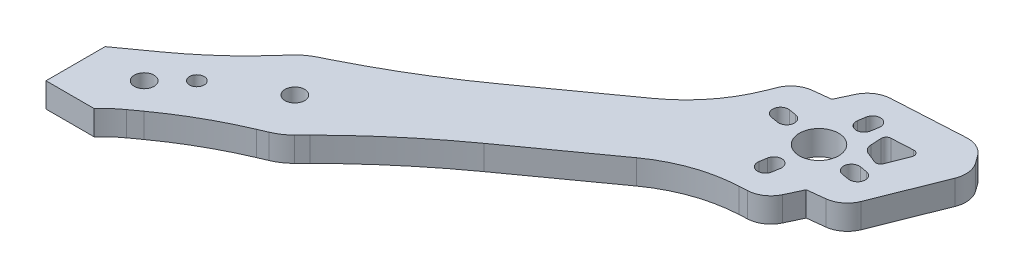
from build123d import *

# Parameters (mm, degrees)
SKETCH2_R           = 2
SKETCH2_R_2         = 1.5
SKETCH2_R_3         = 4
BOSS_EXTRUDE1_DEPTH = 5


with BuildPart() as part:
    # Sketch2 → Boss-Extrude1 (new body)
    with BuildSketch(Plane(origin=(0, 0, 0), x_dir=(1, 0, 0), z_dir=(0, 1, 0))):
        with BuildLine():
            Line((96.674187099, 58.214174471), (100.259554689, 58.62537792))
            ThreePointArc((100.259554689, 58.62537792), (102.726861183, 59.620848143), (104.334258678, 61.740950876))
            Line((104.334258678, 61.740950876), (109.788302134, 75.41951978))
            ThreePointArc((109.788302134, 75.41951978), (110.106786378, 77.879348033), (109.203962948, 80.189563845))
            Line((109.203962948, 80.189563845), (108.148744134, 81.65769437))
            ThreePointArc((108.148744134, 81.65769437), (106.246786582, 83.249782532), (103.813742867, 83.731950064))
            Line((103.813742867, 83.731950064), (89.110198155, 82.922252473))
            ThreePointArc((89.110198155, 82.922252473), (86.58833532, 82.074449344), (84.858361795, 80.053124553))
            Line((84.858361795, 80.053124553), (83.325812901, 76.785825529))
            Line((83.325812901, 76.785825529), (79.745407576, 76.375191199))
            ThreePointArc((79.745407576, 76.375191199), (77.270804519, 75.374131292), (75.6639264, 73.24253003))
            Line((75.6639264, 73.24253003), (75.042843012, 71.6680711))
            ThreePointArc((75.042843012, 71.6680711), (70.946054903, 64.491253119), (64.991367673, 58.761323876))
            Line((64.991367673, 58.761323876), (46.931722679, 45.780954047))
            ThreePointArc((46.931722679, 45.780954047), (36.413241445, 38.843477801), (25.372306119, 32.77184118))
            Line((25.372306119, 32.77184118), (23.401205332, 31.788764494))
            ThreePointArc((23.401205332, 31.788764494), (21.793071121, 30.786042702), (20.402989885, 29.497935256))
            Line((20.402989885, 29.497935256), (19.112268572, 28.051458372))
            ThreePointArc((19.112268572, 28.051458372), (13.16458677, 22.078961314), (6.599736248, 16.792338805))
            Line((6.599736248, 16.792338805), (0, 12.048778377))
            Line((0, 12.048778377), (0, 0))
            Line((0, 0), (9.827416163, 0))
            ThreePointArc((9.827416163, 0), (11.473121255, 1.662110783), (13.293458997, 3.130895317))
            Line((13.293458997, 3.130895317), (15.354276971, 4.612108235))
            ThreePointArc((15.354276971, 4.612108235), (22.457631343, 9.149507995), (30.014371949, 12.883314543))
            Line((30.014371949, 12.883314543), (31.796806607, 13.645668513))
            ThreePointArc((31.796806607, 13.645668513), (33.460801696, 14.552678424), (34.923797775, 15.757331529))
            Line((34.923797775, 15.757331529), (36.483864554, 17.312281519))
            ThreePointArc((36.483864554, 17.312281519), (45.757987001, 25.842092678), (55.686263447, 33.60072351))
            Line((55.686263447, 33.60072351), (73.745908403, 46.581093312))
            ThreePointArc((73.745908403, 46.581093312), (81.074965721, 50.398855458), (89.183263316, 51.994442832))
            Line((89.183263316, 51.994442832), (90.873565855, 52.081292528))
            ThreePointArc((90.873565855, 52.081292528), (93.406161944, 52.924938353), (95.143759302, 54.951397494))
            Line((95.143759302, 54.951397494), (96.674187099, 58.214174471))
        make_face()
        with Locations(Location((10.000016395, 10.000011804, 0), (0, 0, 270))):
            Circle(SKETCH2_R, mode=Mode.SUBTRACT)
        with Locations(Location((27.864354565, 22.840004863, 0), (0, 0, 270))):
            Circle(SKETCH2_R, mode=Mode.SUBTRACT)
        with Locations(Location((15.365, 15.365, 0), (0, 0, 270))):
            Circle(SKETCH2_R_2, mode=Mode.SUBTRACT)
        with Locations(Location((90, 67.5, 0), (0, 0, 270))):
            Circle(SKETCH2_R_3, mode=Mode.SUBTRACT)
        with BuildLine():
            Line((100.618872181, 76.169797692), (96.189048483, 75.92936815))
            ThreePointArc((96.189048483, 75.92936815), (95.498854377, 75.598583427), (95.244713564, 74.876642374))
            Line((95.244713564, 74.876642374), (95.363815249, 72.682238728))
            ThreePointArc((95.363815249, 72.682238728), (95.736845201, 71.623357489), (96.621599456, 70.932278091))
            Line((96.621599456, 70.932278091), (98.663587114, 70.119948739))
            ThreePointArc((98.663587114, 70.119948739), (99.428878121, 70.130724305), (99.962401105, 70.679486242))
            Line((99.962401105, 70.679486242), (101.602243357, 74.8016291))
            ThreePointArc((101.602243357, 74.8016291), (101.485082981, 75.754903393), (100.618872181, 76.169797692))
        make_face(mode=Mode.SUBTRACT)
        with BuildLine():
            Line((99.116926829, 64.38685927), (97.636614954, 64.629092122))
            ThreePointArc((97.636614954, 64.629092122), (96.315997331, 66.466473164), (98.153378372, 67.787090788))
            Line((98.153378372, 67.787090788), (99.633690247, 67.544857936))
            ThreePointArc((99.633690247, 67.544857936), (100.95430787, 65.707476894), (99.116926829, 64.38685927))
        make_face(mode=Mode.SUBTRACT)
        with BuildLine():
            Line((93.11314073, 76.616926829), (92.870907878, 75.136614954))
            ThreePointArc((92.870907878, 75.136614954), (91.033526836, 73.815997331), (89.712909212, 75.653378372))
            Line((89.712909212, 75.653378372), (89.955142064, 77.133690247))
            ThreePointArc((89.955142064, 77.133690247), (91.792523106, 78.45430787), (93.11314073, 76.616926829))
        make_face(mode=Mode.SUBTRACT)
        with BuildLine():
            Line((80.366309753, 67.455142064), (81.846621628, 67.212909212))
            ThreePointArc((81.846621628, 67.212909212), (83.684002669, 68.533526836), (82.363385046, 70.370907878))
            Line((82.363385046, 70.370907878), (80.883073171, 70.61314073))
            ThreePointArc((80.883073171, 70.61314073), (79.04569213, 69.292523106), (80.366309753, 67.455142064))
        make_face(mode=Mode.SUBTRACT)
        with BuildLine():
            Line((90.044857936, 57.866309753), (90.287090788, 59.346621628))
            ThreePointArc((90.287090788, 59.346621628), (88.966473164, 61.184002669), (87.129092122, 59.863385046))
            Line((87.129092122, 59.863385046), (86.88685927, 58.383073171))
            ThreePointArc((86.88685927, 58.383073171), (88.207476894, 56.54569213), (90.044857936, 57.866309753))
        make_face(mode=Mode.SUBTRACT)
    extrude(amount=BOSS_EXTRUDE1_DEPTH)


solid = part.part
